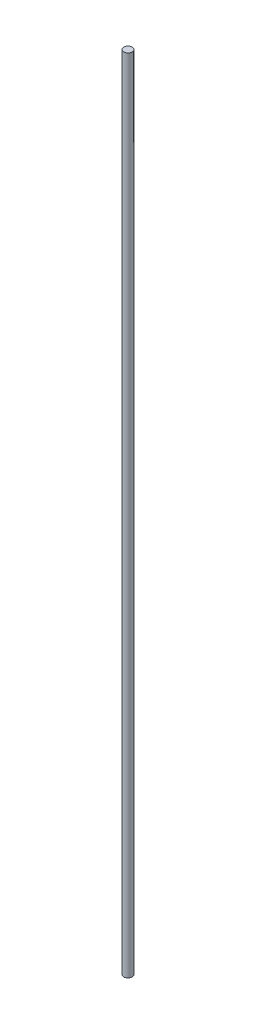
from build123d import *

# Parameters (mm, degrees)
SKETCH2_R           = 3.175
BOSS_EXTRUDE1_DEPTH = 593.725


with BuildPart() as part:
    # Sketch2 → Boss-Extrude1 (new body)
    with BuildSketch(Plane(origin=(0, 0, 0), x_dir=(1, 0, 0), z_dir=(0, 1, 0))):
        with Locations(Location((0, 0, 0), (0, 0, 270))):
            Circle(SKETCH2_R)
    extrude(amount=BOSS_EXTRUDE1_DEPTH)


solid = part.part
